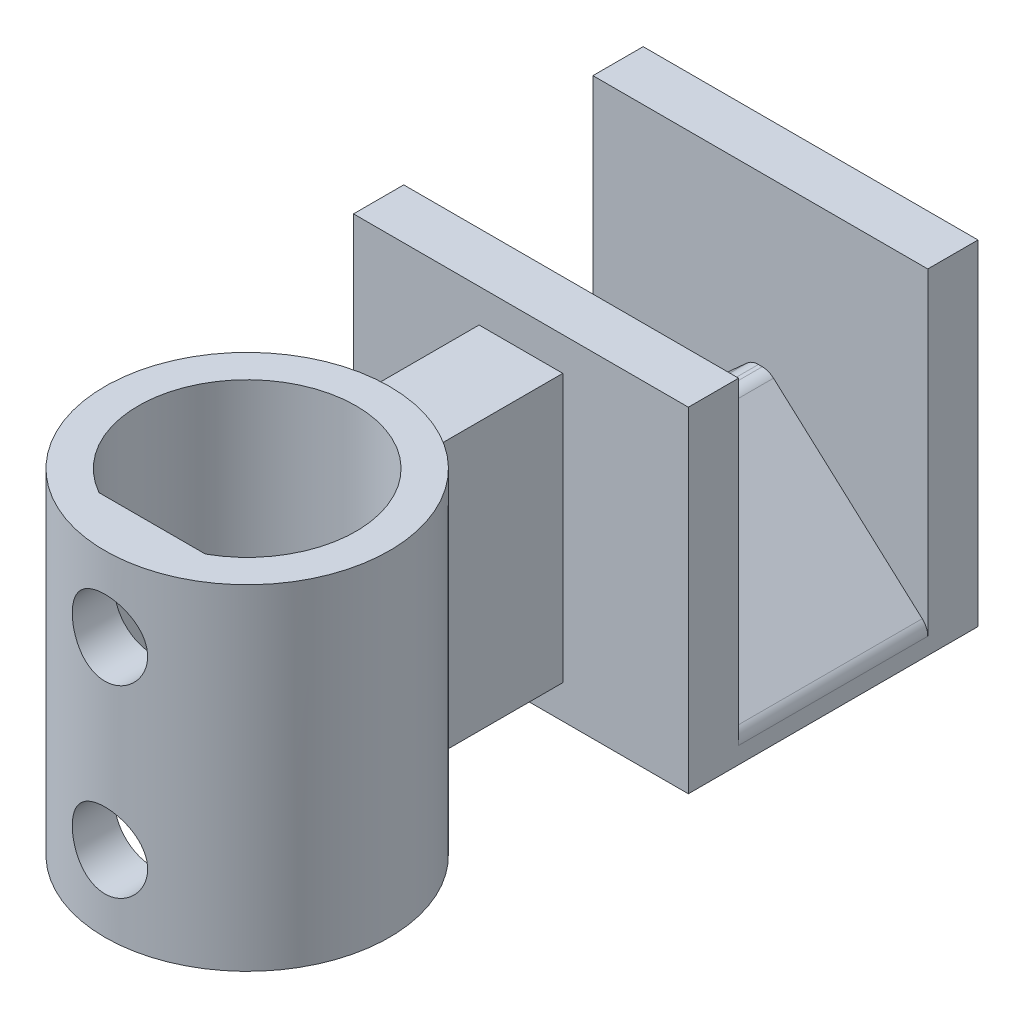
from build123d import *

# Parameters (mm, degrees)
SKETCH2_W                       = 20
SKETCH2_H                       = 10
BOSS_EXTRUDE1_DEPTH             = 5.65
CHAMFER1_SIZE                   = 9.5
CHAMFER1_SIZE2                  = 8.553838421
FILLET3_R                       = 1
SKETCH3_W                       = 20
SKETCH3_H                       = 20
BOSS_EXTRUDE2_DEPTH             = 3
BOSS_EXTRUDE3_REACH             = 21.996
SKETCH6_R                       = 8.5
BOSS_EXTRUDE3_DIRECTION_2_REACH = 21.996
BOSS_EXTRUDE4_REACH             = 32.701
BOSS_EXTRUDE4_END_RADIUS        = 8.5
SKETCH5_W                       = 5
SKETCH5_H                       = 16
CUT_EXTRUDE1_REACH              = 35.85
CUT_EXTRUDE1_END_RADIUS         = 8.5
SKETCH7_R                       = 2.25


with BuildPart() as part:
    # Sketch2 → Boss-Extrude1 (new, symmetric)
    with BuildSketch(Plane.XY):
        Rectangle(SKETCH2_W, SKETCH2_H)
    extrude(amount=BOSS_EXTRUDE1_DEPTH, both=True)

    # Chamfer1
    chamfer1_edges = [part.edges().sort_by_distance(p)[0] for p in [
        (-10, 5, 0),
        (10, 5, 0),
    ]]
    chamfer1_side = [part.faces().sort_by_distance(p)[0] for p in [
        (0, 5, 0),
    ]]
    chamfer(chamfer1_edges, length=CHAMFER1_SIZE, length2=CHAMFER1_SIZE2, reference=chamfer1_side[0])

    # Fillet3
    fillet3_edges = [part.edges().sort_by_distance(p)[0] for p in [
        (-0.5, 5, 0),
        (0.5, 5, 0),
        (10, -3.553838421, 0),
        (-10, -3.553838421, 0),
    ]]
    fillet(fillet3_edges, radius=FILLET3_R)

    # Sketch3 → Boss-Extrude2 (add)
    with BuildSketch(Plane.XY.offset(5.65)):
        with Locations((0, 5)):
            Rectangle(SKETCH3_W, SKETCH3_H)
    boss_extrude2 = extrude(amount=BOSS_EXTRUDE2_DEPTH)

    # Mirror1: Boss-Extrude2 across plane
    add(boss_extrude2.mirror(Plane.XY))


with BuildPart() as body_2:

    # Boss-Extrude3: up to this face of the body (flat: up to its plane)
    boss_extrude3_end = Plane(part.part.faces().sort_by_distance((0, 15, 7.15))[0])
    # Sketch6 → Boss-Extrude3 (new, up to the picked face)
    with BuildSketch(Plane(origin=(0, 0, 0), x_dir=(1, 0, 0), z_dir=(0, 1, 0)), mode=Mode.PRIVATE) as boss_extrude3_sk1:
        with Locations(Location((0, -25, 0), (0, 0, 90))):
            Circle(SKETCH6_R)
        with BuildLine():
            Line((3.175, -30.671805268), (-3.175, -30.671805268))
            ThreePointArc((-3.175, -30.671805268), (0, -18.5), (3.175, -30.671805268))
        make_face(mode=Mode.SUBTRACT)
    boss_extrude3_tool1 = split(extrude(boss_extrude3_sk1.sketch, amount=BOSS_EXTRUDE3_REACH, mode=Mode.PRIVATE), bisect_by=boss_extrude3_end, keep=Keep.BOTH, mode=Mode.PRIVATE)
    add(boss_extrude3_tool1.solids().sort_by(Axis((0, 0, 33.259584), (0, 1, 0)))[0])


    # Boss-Extrude3 direction 2: up to this face of the body (flat: up to its plane)
    boss_extrude3_direction_2_end = Plane(part.part.faces().sort_by_distance((0, -5, 0))[0])
    # Sketch6 → Boss-Extrude3 direction 2 (add, up to the picked face)
    with BuildSketch(Plane(origin=(0, 0, 0), x_dir=(1, 0, 0), z_dir=(0, 1, 0)), mode=Mode.PRIVATE) as boss_extrude3_direction_2_sk1:
        with Locations(Location((0, -25, 0), (0, 0, 90))):
            Circle(SKETCH6_R)
        with BuildLine():
            Line((3.175, -30.671805268), (-3.175, -30.671805268))
            ThreePointArc((-3.175, -30.671805268), (0, -18.5), (3.175, -30.671805268))
        make_face(mode=Mode.SUBTRACT)
    boss_extrude3_direction_2_tool1 = split(extrude(boss_extrude3_direction_2_sk1.sketch, amount=-BOSS_EXTRUDE3_DIRECTION_2_REACH, mode=Mode.PRIVATE), bisect_by=boss_extrude3_direction_2_end, keep=Keep.BOTH, mode=Mode.PRIVATE)
    add(boss_extrude3_direction_2_tool1.solids().sort_by(Axis((0, 0, 33.259584), (0, -1, 0)))[0])


with BuildPart() as part_1:
    add(part.part)

    add(body_2.part)  # Boss-Extrude4 merges body 2
    # Boss-Extrude4: up to this cylinder (the profile starts outside it)
    boss_extrude4_end = Plane(origin=(0, 5, 25), z_dir=(0, -1, 0)) * Cylinder(BOSS_EXTRUDE4_END_RADIUS, 83.402, mode=Mode.PRIVATE)
    # Sketch5 → Boss-Extrude4 (add, up to the surface)
    with BuildSketch(Plane.XY.offset(8.65), mode=Mode.PRIVATE) as boss_extrude4_sk1:
        with Locations((0, 5)):
            Rectangle(SKETCH5_W, SKETCH5_H)
    boss_extrude4_tool1 = extrude(boss_extrude4_sk1.sketch, amount=BOSS_EXTRUDE4_REACH, mode=Mode.PRIVATE) - boss_extrude4_end
    add(boss_extrude4_tool1.solids().sort_by_distance((0, 5, 8.65))[0])

    # Cut-Extrude1: up to this cylinder (the profile starts inside it)
    cut_extrude1_end = Plane(origin=(0, 5, 25), z_dir=(0, -1, 0)) * Cylinder(CUT_EXTRUDE1_END_RADIUS, 100.7, mode=Mode.PRIVATE)
    # Sketch7 → Cut-Extrude1 (cut, up to the surface)
    with BuildSketch(Plane.XY.offset(20), mode=Mode.PRIVATE) as cut_extrude1_sk1:
        with Locations(Location((0, 10.5, 0), (0, 0, 180))):
            Circle(SKETCH7_R)
    cut_extrude1_tool1 = extrude(cut_extrude1_sk1.sketch, amount=CUT_EXTRUDE1_REACH, mode=Mode.PRIVATE) & cut_extrude1_end
    add(cut_extrude1_tool1.solids().sort_by_distance((0, 10.5, 20))[0], mode=Mode.SUBTRACT)
    # Sketch7 → Cut-Extrude1 (cut, up to the surface)
    with BuildSketch(Plane.XY.offset(20), mode=Mode.PRIVATE) as cut_extrude1_sk2:
        with Locations(Location((0, -0.5, 0), (0, 0, 180))):
            Circle(SKETCH7_R)
    cut_extrude1_tool2 = extrude(cut_extrude1_sk2.sketch, amount=CUT_EXTRUDE1_REACH, mode=Mode.PRIVATE) & cut_extrude1_end
    add(cut_extrude1_tool2.solids().sort_by_distance((0, -0.5, 20))[0], mode=Mode.SUBTRACT)


solid = part_1.part
